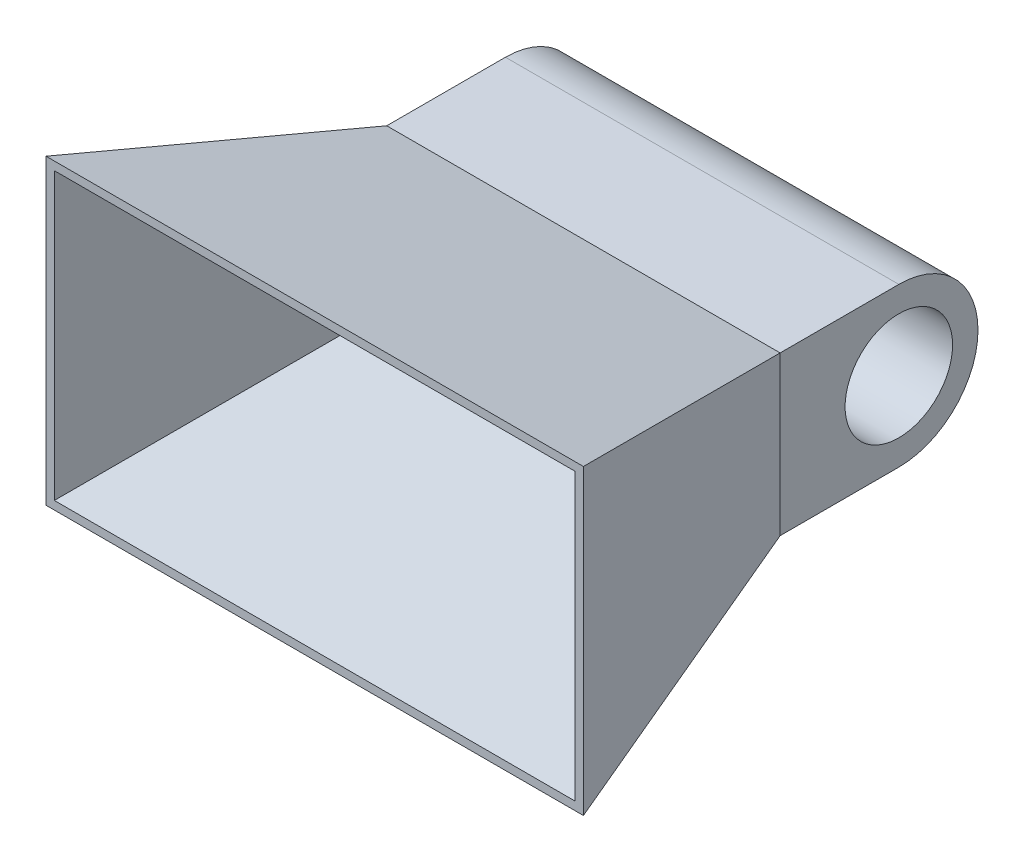
from build123d import *

# Parameters (mm, degrees)
CAMERA_CONE_SKETCH_W      = 200
CAMERA_CONE_SKETCH_H      = 112.5
CAMERA_CONE_EXTRUDE_DEPTH = 100
CAMERA_CONE_EXTRUDE_DRAFT = -15
CAMERA_CONE_SHELL_T       = -3
HINGE_EXTRUDE_DEPTH       = 146.410161514
HINGE_HOLE_SKETCH_R       = 20
HINGE_HOLE_CUT_DEPTH      = 146.410161514


with BuildPart() as part:
    # Camera Cone Sketch → Camera Cone Extrude (with draft: the straight prism first)
    with BuildSketch(Plane.XY):
        Rectangle(CAMERA_CONE_SKETCH_W, CAMERA_CONE_SKETCH_H)
    extrude(amount=-CAMERA_CONE_EXTRUDE_DEPTH)
    # Camera Cone Extrude: the draft: its side faces are tilted about the plane it starts from
    camera_cone_extrude_sides = [part.faces().sort_by_distance(p)[0] for p in [
        (-100, 0, -50),
        (0, -56.25, -50),
        (100, 0, -50),
        (0, 56.25, -50),
    ]]
    draft(camera_cone_extrude_sides, Plane.XY, CAMERA_CONE_EXTRUDE_DRAFT)

    # Camera Cone Shell
    camera_cone_shell_openings = [part.faces().sort_by_distance(p)[0] for p in [
        (0, 0, 0),
    ]]
    offset(amount=CAMERA_CONE_SHELL_T, openings=camera_cone_shell_openings, kind=Kind.INTERSECTION)

    # Hinge Sketch → Hinge Extrude (add)
    with BuildSketch(Plane(origin=(73.205080757, 0, 0), x_dir=(0, 0, -1), z_dir=(1, 0, 0))):
        with BuildLine():
            Line((100, 29.455080757), (144.182621135, 29.455080757))
            ThreePointArc((144.182621135, 29.455080757), (173.637701892, 0), (144.182621135, -29.455080757))
            Line((144.182621135, -29.455080757), (100, -29.455080757))
            Line((100, -29.455080757), (100, 29.455080757))
        make_face()
    extrude(amount=-HINGE_EXTRUDE_DEPTH)

    # Hinge Hole Sketch → Hinge Hole Cut (cut)
    with BuildSketch(Plane(origin=(73.205080757, 0, 0), x_dir=(0, 0, -1), z_dir=(1, 0, 0))):
        with Locations((144.182621135, 0)):
            Circle(HINGE_HOLE_SKETCH_R)
    extrude(amount=-HINGE_HOLE_CUT_DEPTH, mode=Mode.SUBTRACT)


solid = part.part
